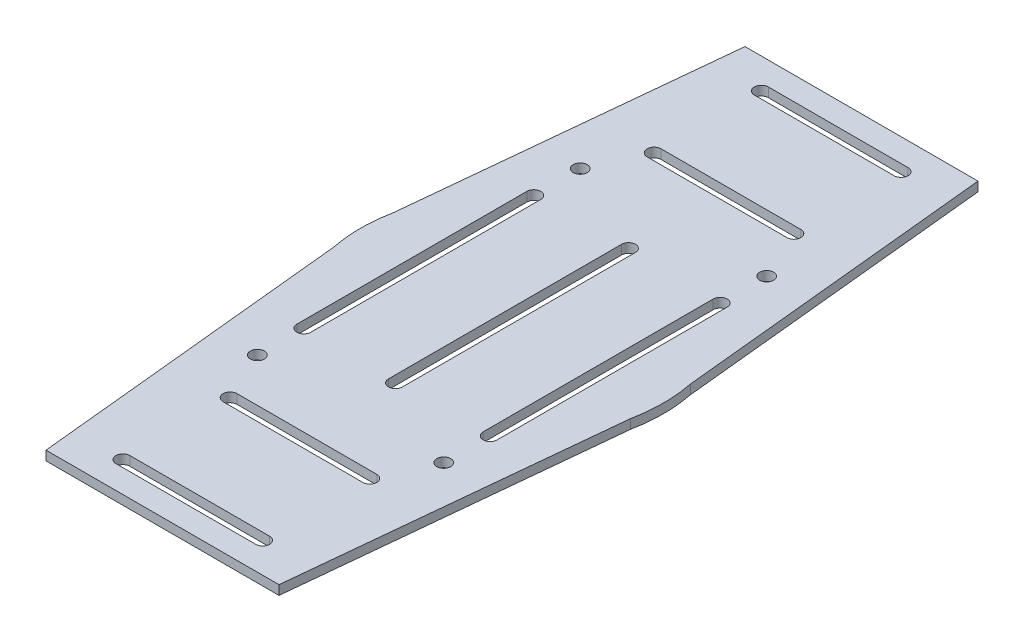
from build123d import *

# Parameters (mm, degrees)
SKETCH1_R           = 1.5
BOSS_EXTRUDE1_DEPTH = 2
CUT_EXTRUDE1_DEPTH  = 2


with BuildPart() as part:
    # Sketch1 → Boss-Extrude1 (new body)
    with BuildSketch(Plane(origin=(0, 0, 0), x_dir=(1, 0, 0), z_dir=(0, 1, 0))):
        with BuildLine():
            Line((-31.856435644, 6.435643564), (-25, 75))
            Line((-25, 75), (25, 75))
            Line((25, 75), (31.856435644, 6.435643564))
            ThreePointArc((31.856435644, 6.435643564), (32.5, 0), (31.856435644, -6.435643564))
            Line((31.856435644, -6.435643564), (25, -75))
            Line((25, -75), (-25, -75))
            Line((-25, -75), (-31.856435644, -6.435643564))
            ThreePointArc((-31.856435644, -6.435643564), (-32.5, 0), (-31.856435644, 6.435643564))
        make_face()
        with Locations(Location((-20, 34.641016151, 0), (0, 0, 270))):
            Circle(SKETCH1_R, mode=Mode.SUBTRACT)
        with Locations(Location((20, 34.641016151, 0), (0, 0, 90))):
            Circle(SKETCH1_R, mode=Mode.SUBTRACT)
        with Locations(Location((20, -34.641016151, 0), (0, 0, 270))):
            Circle(SKETCH1_R, mode=Mode.SUBTRACT)
        with Locations(Location((-20, -34.641016151, 0), (0, 0, 90))):
            Circle(SKETCH1_R, mode=Mode.SUBTRACT)
    extrude(amount=BOSS_EXTRUDE1_DEPTH)

    # Sketch2 → Cut-Extrude1 (cut)
    with BuildSketch(Plane(origin=(0, 2, 0), x_dir=(1, 0, 0), z_dir=(0, 1, 0))):
        with BuildLine():
            Line((-15, 70), (15, 70))
            ThreePointArc((15, 70), (16.5, 68.5), (15, 67))
            Line((15, 67), (-15, 67))
            ThreePointArc((-15, 67), (-16.5, 68.5), (-15, 70))
        make_face()
        with BuildLine():
            Line((-15, -70), (15, -70))
            ThreePointArc((15, -70), (16.5, -68.5), (15, -67))
            Line((15, -67), (-15, -67))
            ThreePointArc((-15, -67), (-16.5, -68.5), (-15, -70))
        make_face()
        with BuildLine():
            Line((-15, 44), (15, 44))
            ThreePointArc((15, 44), (16.5, 45.5), (15, 47))
            Line((15, 47), (-15, 47))
            ThreePointArc((-15, 47), (-16.5, 45.5), (-15, 44))
        make_face()
        with BuildLine():
            Line((-15, -44), (15, -44))
            ThreePointArc((15, -44), (16.5, -45.5), (15, -47))
            Line((15, -47), (-15, -47))
            ThreePointArc((-15, -47), (-16.5, -45.5), (-15, -44))
        make_face()
        with BuildLine():
            Line((-18.5, 24.682455481), (-18.5, -24.682555481))
            ThreePointArc((-18.5, -24.682555481), (-20, -26.182555481), (-21.5, -24.682555481))
            Line((-21.5, -24.682555481), (-21.5, 24.682455481))
            ThreePointArc((-21.5, 24.682455481), (-20, 26.182455481), (-18.5, 24.682455481))
        make_face()
        with BuildLine():
            Line((18.5, 24.682455481), (18.5, -24.682555481))
            ThreePointArc((18.5, -24.682555481), (20, -26.182555481), (21.5, -24.682555481))
            Line((21.5, -24.682555481), (21.5, 24.682455481))
            ThreePointArc((21.5, 24.682455481), (20, 26.182455481), (18.5, 24.682455481))
        make_face()
        with BuildLine():
            Line((1.5, 25), (1.5, -25))
            ThreePointArc((1.5, -25), (0, -26.5), (-1.5, -25))
            Line((-1.5, -25), (-1.5, 25))
            ThreePointArc((-1.5, 25), (0, 26.5), (1.5, 25))
        make_face()
    extrude(amount=-CUT_EXTRUDE1_DEPTH, mode=Mode.SUBTRACT)


solid = part.part
